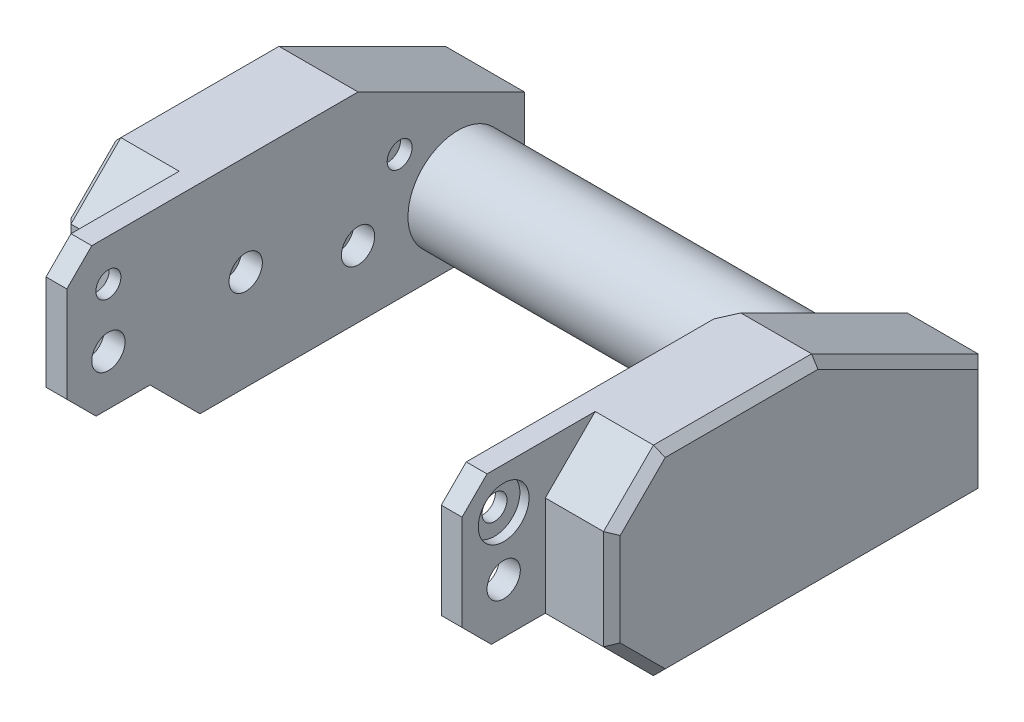
from build123d import *

# Parameters (mm, degrees)
SKETCH2_W                      = 45
SKETCH2_H                      = 24
BOSS_EXTRUDE1_DEPTH            = 50
CUT_EXTRUDE7_DEPTH             = 50
CHAMFER4_SIZE                  = 6
CUT_EXTRUDE1_REACH             = 70.33
SKETCH3_W                      = 45
SKETCH3_H                      = 10
CUT_EXTRUDE2_REACH             = 55.912
SKETCH4_R                      = 2
CUT_EXTRUDE2_DIRECTION_2_REACH = 55.912
SKETCH8_W                      = 45
SKETCH8_H                      = 50
CUT_EXTRUDE4_DEPTH             = 14
SKETCH6_R                      = 6
BOSS_EXTRUDE2_DEPTH            = 45
CUT_EXTRUDE3_START             = -50
SKETCH7_R                      = 2
CUT_EXTRUDE3_DEPTH             = 50
CUT_EXTRUDE6_START             = -2.5
SKETCH13_R                     = 2
CUT_EXTRUDE6_DEPTH             = 50
BOSS_EXTRUDE16_REACH           = 58.127
CUT_EXTRUDE13_REACH            = 64.292
SKETCH30_W                     = 45
SKETCH30_H                     = 10
CUT_EXTRUDE18_START            = -50
SKETCH37_R                     = 2
CUT_EXTRUDE18_DEPTH            = 50
CUT_EXTRUDE20_REACH            = 62.83
SKETCH43_R                     = 1.5
SKETCH44_R                     = 3.05
CUT_EXTRUDE21_DEPTH            = 1.1
SKETCH45_R                     = 3.05
CUT_EXTRUDE22_DEPTH            = 1.1
BOSS_EXTRUDE23_DEPTH           = 2.5
BOSS_EXTRUDE24_DEPTH           = 2.5
SKETCH55_R                     = 3.05
CUT_EXTRUDE28_DEPTH            = 1.1
CUT_EXTRUDE29_START            = -50
SKETCH57_R                     = 1.5
CUT_EXTRUDE29_DEPTH            = 48.9
SKETCH58_R                     = 3.05
CUT_EXTRUDE30_DEPTH            = 1.1
CHAMFER11_SIZE                 = 3
BOSS_EXTRUDE19_DEPTH           = 8
BOSS_EXTRUDE20_DEPTH           = 8
CHAMFER7_SIZE                  = 1
CHAMFER8_SIZE                  = 1


with BuildPart() as part:
    # Sketch2 → Boss-Extrude1 (new body)
    with BuildSketch(Plane(origin=(0, 0, 0), x_dir=(0, 0, -1), z_dir=(1, 0, 0))):
        Rectangle(SKETCH2_W, SKETCH2_H)
    extrude(amount=BOSS_EXTRUDE1_DEPTH)

    # Sketch14 → Cut-Extrude7 (cut)
    with BuildSketch(Plane(origin=(50, 0, 0), x_dir=(0, 0, -1), z_dir=(1, 0, 0))):
        Polygon((2.5, 12), (22.5, 2), (22.5, 12), align=None)
    extrude(amount=-CUT_EXTRUDE7_DEPTH, mode=Mode.SUBTRACT)

    # Chamfer4
    chamfer4_edges = [part.edges().sort_by_distance(p)[0] for p in [
        (25, -12, 22.5),
        (25, 12, 22.5),
    ]]
    chamfer(chamfer4_edges, length=CHAMFER4_SIZE)

    # Cut-Extrude1: up to this face of the body (flat: up to its plane)
    cut_extrude1_end = Plane(part.part.faces().sort_by_distance((25, 0, 22.5))[0])
    # Sketch3 → Cut-Extrude1 (cut, up to the picked face)
    with BuildSketch(Plane(origin=(0, 0, -22.5), x_dir=(-1, 0, 0), z_dir=(0, 0, -1)), mode=Mode.PRIVATE) as cut_extrude1_sk1:
        with Locations((-25, -7)):
            Rectangle(SKETCH3_W, SKETCH3_H)
    cut_extrude1_tool1 = split(extrude(cut_extrude1_sk1.sketch, amount=-CUT_EXTRUDE1_REACH, mode=Mode.PRIVATE), bisect_by=cut_extrude1_end, keep=Keep.BOTH, mode=Mode.PRIVATE)
    add(cut_extrude1_tool1.solids().sort_by(Axis((25, -7, -22.5), (0, 0, 1)))[0], mode=Mode.SUBTRACT)

    # Cut-Extrude2: up to this face of the body (flat: up to its plane)
    cut_extrude2_end = Plane(part.part.faces().sort_by_distance((50, -0.918079096, 0.895480226))[0])
    # Sketch4 → Cut-Extrude2 (cut, up to the picked face)
    with BuildSketch(Plane(origin=(2.5, 0, 0), x_dir=(0, 0, -1), z_dir=(1, 0, 0)), mode=Mode.PRIVATE) as cut_extrude2_sk1:
        with Locations(Location((14.5, -4, 0), (0, 0, 180))):
            Circle(SKETCH4_R)
    cut_extrude2_tool1 = split(extrude(cut_extrude2_sk1.sketch, amount=CUT_EXTRUDE2_REACH, mode=Mode.PRIVATE), bisect_by=cut_extrude2_end, keep=Keep.BOTH, mode=Mode.PRIVATE)
    add(cut_extrude2_tool1.solids().sort_by(Axis((2.5, -4, -14.5), (1, 0, 0)))[0], mode=Mode.SUBTRACT)

    # Cut-Extrude2 direction 2: up to this face of the body (flat: up to its plane)
    cut_extrude2_direction_2_end = Plane(part.part.faces().sort_by_distance((0, -0.918079096, 0.895480226))[0])
    # Sketch4 → Cut-Extrude2 direction 2 (cut, up to the picked face)
    with BuildSketch(Plane(origin=(2.5, 0, 0), x_dir=(0, 0, -1), z_dir=(1, 0, 0)), mode=Mode.PRIVATE) as cut_extrude2_direction_2_sk1:
        with Locations(Location((14.5, -4, 0), (0, 0, 180))):
            Circle(SKETCH4_R)
    cut_extrude2_direction_2_tool1 = split(extrude(cut_extrude2_direction_2_sk1.sketch, amount=-CUT_EXTRUDE2_DIRECTION_2_REACH, mode=Mode.PRIVATE), bisect_by=cut_extrude2_direction_2_end, keep=Keep.BOTH, mode=Mode.PRIVATE)
    add(cut_extrude2_direction_2_tool1.solids().sort_by(Axis((2.5, -4, -14.5), (-1, 0, 0)))[0], mode=Mode.SUBTRACT)

    # Sketch8 → Cut-Extrude4 (cut)
    with BuildSketch(Plane(origin=(0, 12, 0), x_dir=(1, 0, 0), z_dir=(0, 1, 0))):
        with Locations((25, 2.5)):
            Rectangle(SKETCH8_W, SKETCH8_H)
    extrude(amount=-CUT_EXTRUDE4_DEPTH, mode=Mode.SUBTRACT)


with BuildPart() as cut_extrude4_piece_1:
    # of the separate pieces the step leaves, piece 1, a body of its own (cut_extrude4_pieces)
    add(part.part.solids().sort_by_distance((0, -12, 16.5))[0])


with BuildPart() as cut_extrude4_piece_2:
    # of the separate pieces the step leaves, piece 2, a body of its own (cut_extrude4_pieces)
    add(part.part.solids().sort_by_distance((50, 2, -22.5))[0])

    # Sketch6 → Boss-Extrude2 (add)
    with BuildSketch(Plane(origin=(2.5, 0, 0), x_dir=(0, 0, -1), z_dir=(1, 0, 0))):
        with Locations(Location((14.5, -4, 0), (0, 0, 90))):
            Circle(SKETCH6_R)
    extrude(amount=BOSS_EXTRUDE2_DEPTH)


with BuildPart() as cut_extrude3_tool:
    # Sketch7 → Cut-Extrude3 (new body)
    with BuildSketch(Plane.ZY.offset(CUT_EXTRUDE3_START)):
        with Locations((11, 0)):
            Circle(SKETCH7_R)
    extrude(amount=CUT_EXTRUDE3_DEPTH)


with BuildPart() as cut_extrude4_piece_1_1:
    add(cut_extrude4_piece_1.part)

    # Cut-Extrude3: cut by cut_extrude3_tool
    add(cut_extrude3_tool.part, mode=Mode.SUBTRACT)


with BuildPart() as cut_extrude4_piece_2_1:
    add(cut_extrude4_piece_2.part)

    # Cut-Extrude3: cut by cut_extrude3_tool
    add(cut_extrude3_tool.part, mode=Mode.SUBTRACT)


with BuildPart() as cut_extrude6_tool:
    # Sketch13 → Cut-Extrude6 (new body)
    with BuildSketch(Plane.ZY.offset(-47.5).offset(CUT_EXTRUDE6_START)):
        with Locations(Location((-2.5, -4, 0), (0, 0, 270))):
            Circle(SKETCH13_R)
    extrude(amount=CUT_EXTRUDE6_DEPTH)


with BuildPart() as cut_extrude4_piece_1_2:
    add(cut_extrude4_piece_1_1.part)

    # Cut-Extrude6: cut by cut_extrude6_tool
    add(cut_extrude6_tool.part, mode=Mode.SUBTRACT)


with BuildPart() as cut_extrude4_piece_2_2:
    add(cut_extrude4_piece_2_1.part)

    # Cut-Extrude6: cut by cut_extrude6_tool
    add(cut_extrude6_tool.part, mode=Mode.SUBTRACT)

    # Boss-Extrude16: up to this face of the body (flat: up to its plane)
    boss_extrude16_end = Plane(cut_extrude4_piece_2_2.part.faces().sort_by_distance((50, -0.845343651, 1.015922603))[0])
    # Sketch29 → Boss-Extrude16 (add, up to the picked face)
    with BuildSketch(Plane.ZY, mode=Mode.PRIVATE) as boss_extrude16_sk1:
        Polygon((28.985281374, 6), (22.5, 6), (22.5, -6), (28.985281374, -6), (32.5, -2.485281374), (32.5, 2.485281374), align=None)
    boss_extrude16_tool1 = split(extrude(boss_extrude16_sk1.sketch, amount=-BOSS_EXTRUDE16_REACH, mode=Mode.PRIVATE), bisect_by=boss_extrude16_end, keep=Keep.BOTH, mode=Mode.PRIVATE)

    add(cut_extrude4_piece_1_2.part)  # Boss-Extrude16 merges Cut-Extrude4 piece 1
    add(boss_extrude16_tool1.solids().sort_by(Axis((0, 0, 27.06066), (1, 0, 0)))[0])

    # Cut-Extrude13: up to this plane
    cut_extrude13_end = Plane(origin=(65.620499352, -6, 28.985281374), z_dir=(0, -0.7071067811865474, 0.7071067811865477))
    # Sketch30 → Cut-Extrude13 (cut, up to the surface)
    with BuildSketch(Plane(origin=(0, 6, 0), x_dir=(1, 0, 0), z_dir=(0, 1, 0)), mode=Mode.PRIVATE) as cut_extrude13_sk1:
        with Locations((25, -27.5)):
            Rectangle(SKETCH30_W, SKETCH30_H)
    cut_extrude13_tool1 = split(extrude(cut_extrude13_sk1.sketch, amount=-CUT_EXTRUDE13_REACH, mode=Mode.PRIVATE), bisect_by=cut_extrude13_end, keep=Keep.BOTH, mode=Mode.PRIVATE)
    add(cut_extrude13_tool1.solids().sort_by_distance((25, 6, 27.5))[0], mode=Mode.SUBTRACT)

    # Sketch37 → Cut-Extrude18 (cut)
    with BuildSketch(Plane.ZY.offset(CUT_EXTRUDE18_START)):
        with Locations((27.5, 0)):
            Circle(SKETCH37_R)
    extrude(amount=CUT_EXTRUDE18_DEPTH, mode=Mode.SUBTRACT)

    # Cut-Extrude20: up to this face of the body (flat: up to its plane)
    cut_extrude20_end = Plane(cut_extrude4_piece_2_2.part.faces().sort_by_distance((0, -0.765078921, 3.483337135))[0])
    # Sketch43 → Cut-Extrude20 (cut, up to the picked face)
    with BuildSketch(Plane(origin=(50, 0, 0), x_dir=(0, 0, -1), z_dir=(1, 0, 0)), mode=Mode.PRIVATE) as cut_extrude20_sk1:
        with Locations((7.5, 3)):
            Circle(SKETCH43_R)
    cut_extrude20_tool1 = split(extrude(cut_extrude20_sk1.sketch, amount=-CUT_EXTRUDE20_REACH, mode=Mode.PRIVATE), bisect_by=cut_extrude20_end, keep=Keep.BOTH, mode=Mode.PRIVATE)
    add(cut_extrude20_tool1.solids().sort_by(Axis((50, 3, -7.5), (-1, 0, 0)))[0], mode=Mode.SUBTRACT)

    # Sketch44 → Cut-Extrude21 (cut)
    with BuildSketch(Plane(origin=(50, 0, 0), x_dir=(0, 0, -1), z_dir=(1, 0, 0))):
        with Locations((7.5, 3)):
            Circle(SKETCH44_R)
    extrude(amount=-CUT_EXTRUDE21_DEPTH, mode=Mode.SUBTRACT)

    # Sketch45 → Cut-Extrude22 (cut)
    with BuildSketch(Plane.ZY):
        with Locations(Location((-7.5, 3, 0), (0, 0, 180))):
            Circle(SKETCH45_R)
    extrude(amount=-CUT_EXTRUDE22_DEPTH, mode=Mode.SUBTRACT)

    # Sketch48 → Boss-Extrude23 (add)
    with BuildSketch(Plane(origin=(50, 0, 0), x_dir=(0, 0, -1), z_dir=(1, 0, 0))):
        Polygon((-16.5, 12), (-22.5, 6), (-28.985281374, 6), (-32.5, 2.485281374), (-32.5, 12), align=None)
    extrude(amount=-BOSS_EXTRUDE23_DEPTH)

    # Sketch49 → Boss-Extrude24 (add)
    with BuildSketch(Plane.ZY):
        Polygon((28.985281374, 6), (22.5, 6), (16.5, 12), (32.5, 12), (32.5, 2.485281374), align=None)
    extrude(amount=-BOSS_EXTRUDE24_DEPTH)

    # Sketch55 → Cut-Extrude28 (cut)
    with BuildSketch(Plane.ZY):
        with Locations((27.5, 7)):
            Circle(SKETCH55_R)
    extrude(amount=-CUT_EXTRUDE28_DEPTH, mode=Mode.SUBTRACT)

    # Sketch57 → Cut-Extrude29 (cut)
    with BuildSketch(Plane.ZY.offset(CUT_EXTRUDE29_START)):
        with Locations((27.5, 7)):
            Circle(SKETCH57_R)
    extrude(amount=CUT_EXTRUDE29_DEPTH, mode=Mode.SUBTRACT)

    # Sketch58 → Cut-Extrude30 (cut)
    with BuildSketch(Plane(origin=(50, 0, 0), x_dir=(0, 0, -1), z_dir=(1, 0, 0))):
        with Locations(Location((-27.5, 7, 0), (0, 0, 180))):
            Circle(SKETCH58_R)
    extrude(amount=-CUT_EXTRUDE30_DEPTH, mode=Mode.SUBTRACT)

    # Chamfer11
    chamfer11_edges = [cut_extrude4_piece_2_2.edges().sort_by_distance(p)[0] for p in [
        (48.75, 12, 32.5),
        (1.25, 12, 32.5),
    ]]
    chamfer(chamfer11_edges, length=CHAMFER11_SIZE)

    # Sketch38 → Boss-Extrude19 (add)
    with BuildSketch(Plane.ZY):
        Polygon((-2.5, 12), (-22.5, 2), (-22.5, -12), (16.5, -12), (22.5, -6), (22.5, 6), (16.5, 12), align=None)
    extrude(amount=BOSS_EXTRUDE19_DEPTH)

    # Sketch39 → Boss-Extrude20 (add)
    with BuildSketch(Plane(origin=(50, 0, 0), x_dir=(0, 0, -1), z_dir=(1, 0, 0))):
        Polygon((-22.5, 6), (-22.5, -6), (-16.5, -12), (22.5, -12), (22.5, 2), (2.5, 12), (-16.5, 12), align=None)
    extrude(amount=BOSS_EXTRUDE20_DEPTH)

    # Chamfer7
    chamfer7_edges = [cut_extrude4_piece_2_2.edges().sort_by_distance(p)[0] for p in [
        (-8, 12, 7),
        (-8, 7, -12.5),
        (-8, -5, -22.5),
        (-8, -12, -3),
        (-8, -9, 19.5),
        (-8, 0, 22.5),
        (-8, 9, 19.5),
        (58, 9, 19.5),
        (58, 0, 22.5),
        (58, -9, 19.5),
        (58, -12, -3),
        (58, -5, -22.5),
        (58, 7, -12.5),
        (58, 12, 7),
    ]]
    chamfer(chamfer7_edges, length=CHAMFER7_SIZE)

    # Chamfer8
    chamfer8_edges = [cut_extrude4_piece_2_2.edges().sort_by_distance(p)[0] for p in [
        (47.5, -12, -3),
        (47.5, -5, -22.5),
        (47.5, -9, 19.5),
        (47.5, 7, -12.5),
    ]]
    chamfer(chamfer8_edges, length=CHAMFER8_SIZE)


solid = cut_extrude4_piece_2_2.part
